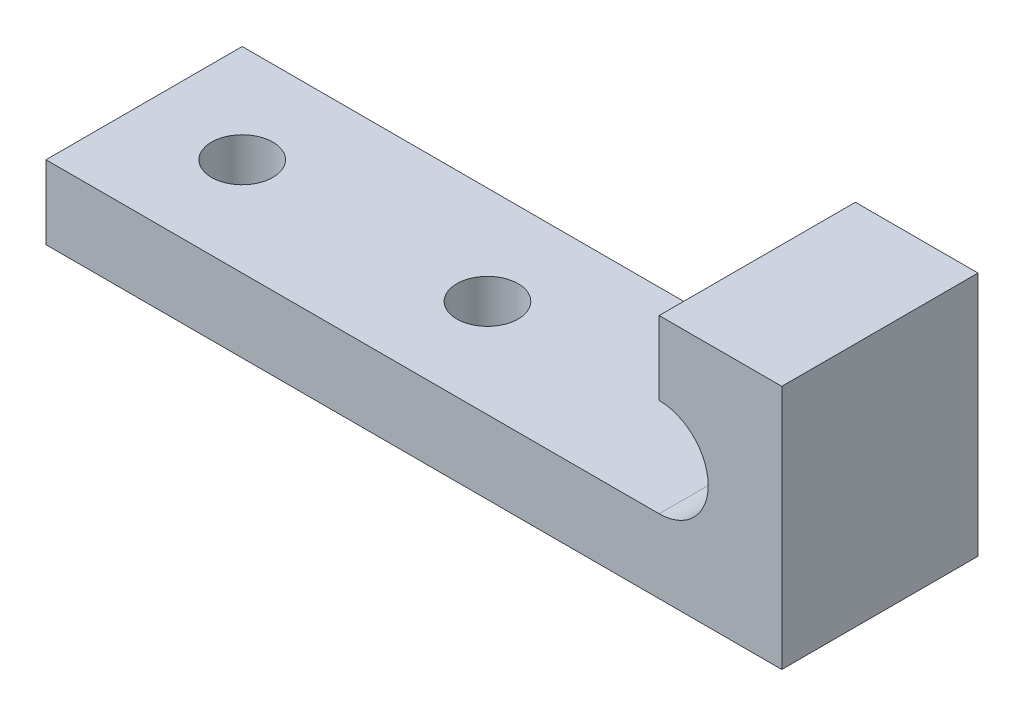
from build123d import *

# Parameters (mm, degrees)
SKETCH1_W           = 20
SKETCH1_H           = 10
BOSS_EXTRUDE1_DEPTH = 8
CUT_EXTRUDE2_DEPTH  = 8
SKETCH3_W           = 10
SKETCH3_H           = 3
BOSS_EXTRUDE2_DEPTH = 8
SKETCH4_R           = 1.25
CUT_EXTRUDE3_DEPTH  = 8
SKETCH5_R           = 1.25
CUT_EXTRUDE4_DEPTH  = 8


with BuildPart() as part:
    # Sketch1 → Boss-Extrude1 (new body)
    with BuildSketch(Plane.XY):
        with Locations((-58.400678179, 28.460872298)):
            Rectangle(SKETCH1_W, SKETCH1_H)
    extrude(amount=BOSS_EXTRUDE1_DEPTH)

    # Sketch2 → Cut-Extrude2 (cut)
    with BuildSketch(Plane.XY.offset(8)):
        with BuildLine():
            Line((-53.400678179, 33.460872298), (-53.400678179, 30.460872298))
            ThreePointArc((-53.400678179, 30.460872298), (-51.400678179, 28.460872298), (-53.400678179, 26.460872298))
            Line((-53.400678179, 26.460872298), (-68.400678179, 26.460872298))
            Line((-68.400678179, 26.460872298), (-68.400678179, 33.460872298))
            Line((-68.400678179, 33.460872298), (-53.400678179, 33.460872298))
        make_face()
    extrude(amount=-CUT_EXTRUDE2_DEPTH, mode=Mode.SUBTRACT)

    # Sketch3 → Boss-Extrude2 (add)
    with BuildSketch(Plane.XY.offset(8)):
        with Locations((-73.400678179, 24.960872298)):
            Rectangle(SKETCH3_W, SKETCH3_H)
    extrude(amount=-BOSS_EXTRUDE2_DEPTH)

    # Sketch4 → Cut-Extrude3 (cut)
    with BuildSketch(Plane(origin=(0, 26.460872298, 0), x_dir=(1, 0, 0), z_dir=(0, 1, 0))):
        with Locations(Location((-74.400678179, -4, 0), (0, 0, 270))):
            Circle(SKETCH4_R)
    extrude(amount=-CUT_EXTRUDE3_DEPTH, mode=Mode.SUBTRACT)

    # Sketch5 → Cut-Extrude4 (cut)
    with BuildSketch(Plane(origin=(0, 26.460872298, 0), x_dir=(1, 0, 0), z_dir=(0, 1, 0))):
        with Locations(Location((-64.400678179, -4, 0), (0, 0, 270))):
            Circle(SKETCH5_R)
    extrude(amount=-CUT_EXTRUDE4_DEPTH, mode=Mode.SUBTRACT)


solid = part.part
